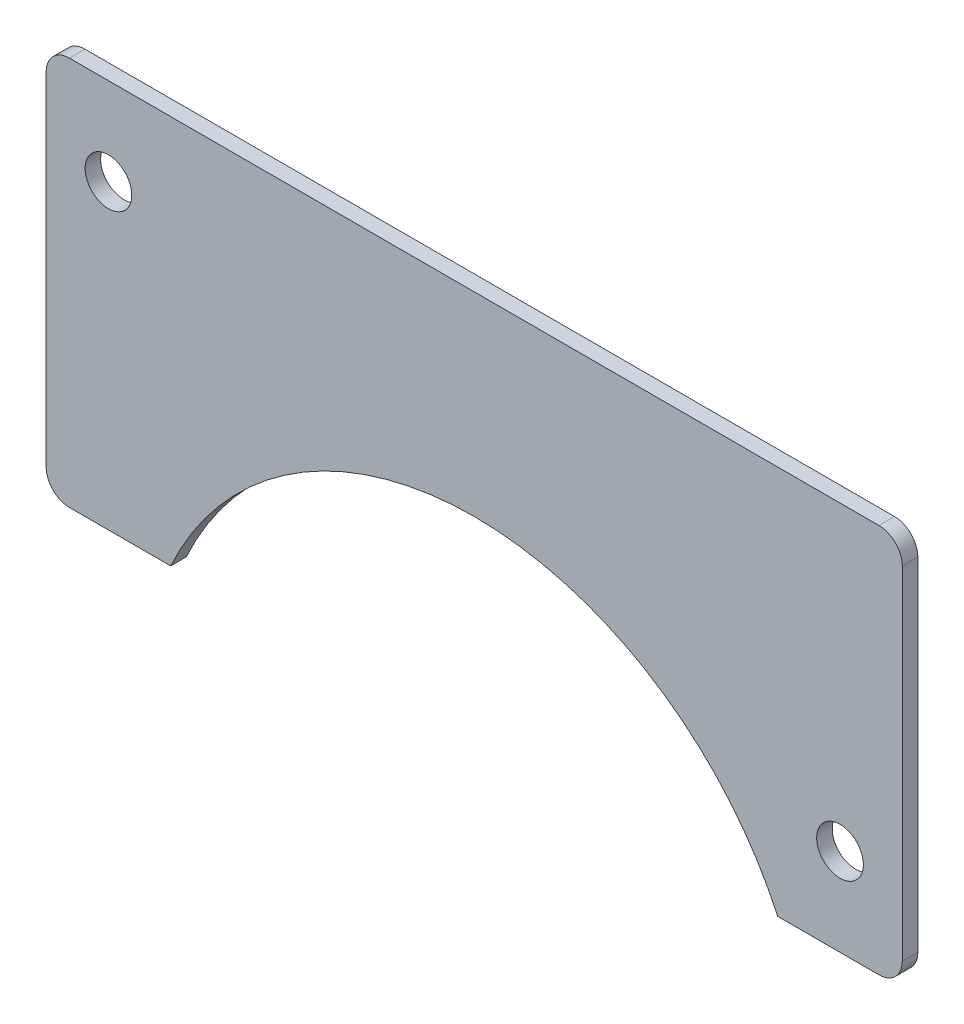
from build123d import *

# Parameters (mm, degrees)
IZIM1_R                     = 30
Y_KSEKLIK_EKSTR_ZYON1_DEPTH = 20
KES_EKSTR_ZYON1_DEPTH       = 20


with BuildPart() as part:
    # Çizim1 → Yükseklik-Ekstrüzyon1 (new body)
    with BuildSketch(Plane.XY):
        with BuildLine():
            Line((-30, 0), (-1070, 0))
            ThreePointArc((-1070, 0), (-1091.213203436, 8.786796564), (-1100, 30))
            Line((-1100, 30), (-1100, 470))
            ThreePointArc((-1100, 470), (-1091.213203436, 491.213203436), (-1070, 500))
            Line((-1070, 500), (-30, 500))
            ThreePointArc((-30, 500), (-8.786796564, 491.213203436), (0, 470))
            Line((0, 470), (0, 30))
            ThreePointArc((0, 30), (-8.786796564, 8.786796564), (-30, 0))
        make_face()
        with Locations((-1020, 387.5)):
            Circle(IZIM1_R, mode=Mode.SUBTRACT)
        with Locations((-80, 112.5)):
            Circle(IZIM1_R, mode=Mode.SUBTRACT)
    extrude(amount=Y_KSEKLIK_EKSTR_ZYON1_DEPTH)

    # Çizim2 → Kes-Ekstrüzyon1 (cut)
    with BuildSketch(Plane(origin=(0, 0, 0), x_dir=(-1, 0, 0), z_dir=(0, 0, -1))):
        with BuildLine():
            Line((940, 0), (160, 0))
            ThreePointArc((160, 0), (550, 250), (940, 0))
        make_face()
    extrude(amount=-KES_EKSTR_ZYON1_DEPTH, mode=Mode.SUBTRACT)


solid = part.part
